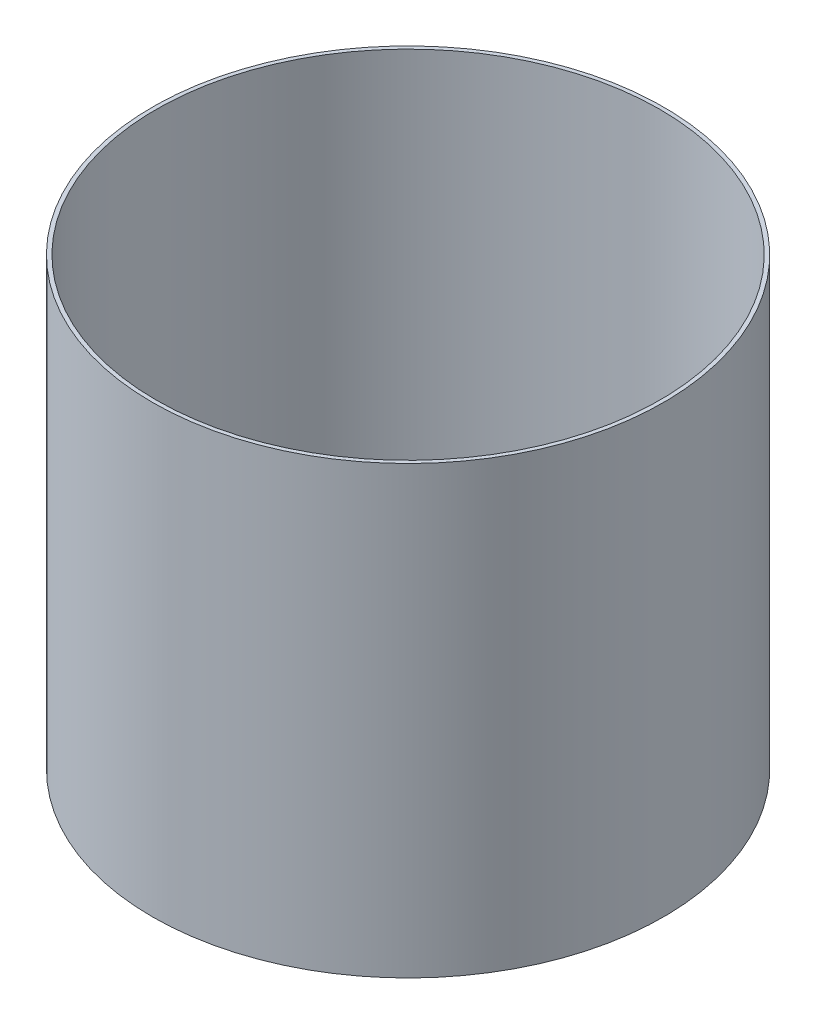
from build123d import *

# Parameters (mm, degrees)
SKETCH1_R           = 335.28
BOSS_EXTRUDE2_DEPTH = 584.2
SKETCH2_R           = 330.2
CUT_EXTRUDE2_DEPTH  = 558.8


with BuildPart() as part:
    # Sketch1 → Boss-Extrude2 (new body)
    with BuildSketch(Plane(origin=(0, 0, 0), x_dir=(1, 0, 0), z_dir=(0, 1, 0))):
        with Locations(Location((0, 0, 0), (0, 0, 270))):
            Circle(SKETCH1_R)
    extrude(amount=BOSS_EXTRUDE2_DEPTH)

    # Sketch2 → Cut-Extrude2 (cut)
    with BuildSketch(Plane(origin=(0, 584.2, 0), x_dir=(1, 0, 0), z_dir=(0, 1, 0))):
        with Locations(Location((0, 0, 0), (0, 0, 270))):
            Circle(SKETCH2_R)
    extrude(amount=-CUT_EXTRUDE2_DEPTH, mode=Mode.SUBTRACT)


solid = part.part
